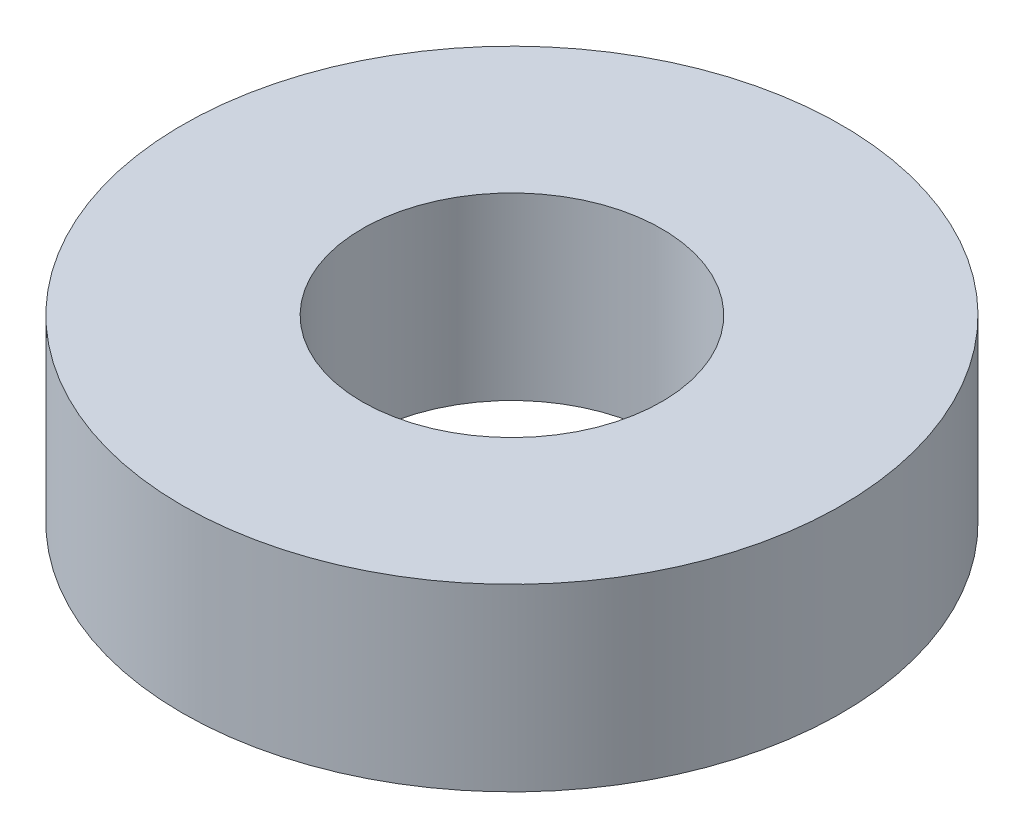
from build123d import *

# Parameters (mm, degrees)
SKETCH_1_R      = 5.5
SKETCH_1_R_2    = 2.5
EXTRUDE_1_DEPTH = 3


with BuildPart() as part:
    # 草图1 → 凸台-拉伸1 (new body)
    with BuildSketch(Plane(origin=(0, 0, 0), x_dir=(1, 0, 0), z_dir=(0, 1, 0))):
        with Locations(Location((0, 0, 0), (0, 0, 270))):
            Circle(SKETCH_1_R)
        with Locations(Location((0, 0, 0), (0, 0, 270))):
            Circle(SKETCH_1_R_2, mode=Mode.SUBTRACT)
    extrude(amount=EXTRUDE_1_DEPTH)


solid = part.part
